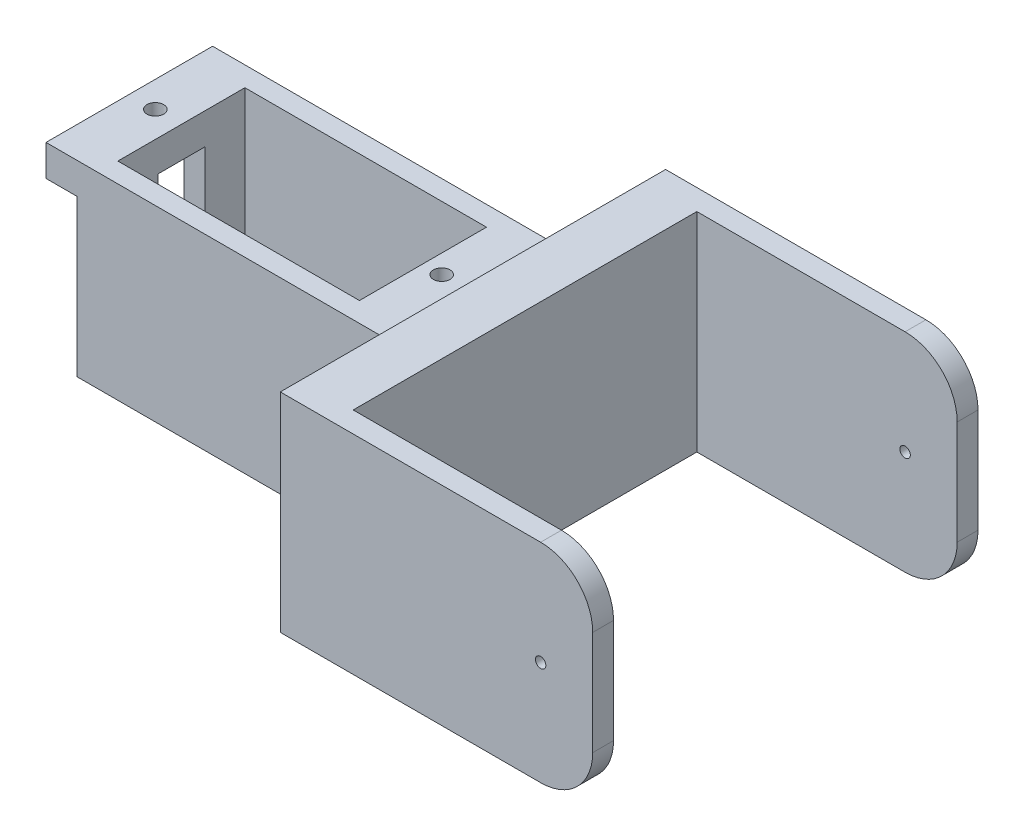
from build123d import *

# Parameters (mm, degrees)
SKETCH1_W               = 30
SKETCH1_H               = 16
BOSS_EXTRUDE1_DEPTH     = 2
SKETCH2_W               = 23.2
SKETCH2_H               = 12.2
BOSS_EXTRUDE2_DEPTH     = 16
CUT_EXTRUDE1_REACH      = 36.234
SKETCH3_W               = 4.5
SKETCH3_H               = 13
SKETCH8_R               = 0.8
CUT_EXTRUDE3_DEPTH      = 2
SKETCH9_W               = 5
SKETCH9_H               = 16
SKETCH9_W_2             = 4
BOSS_EXTRUDE4_DEPTH     = 3
SKETCH10_R              = 0.8
CUT_EXTRUDE4_DEPTH      = 5
SKETCH11_W              = 37
SKETCH11_H              = 20
BOSS_EXTRUDE5_DEPTH     = 5
SKETCH12_W              = 2
SKETCH12_H              = 20
BOSS_EXTRUDE6_DEPTH     = 25
FILLET1_R               = 5
CUT_EXTRUDE5_DEPTH      = 62.278054799
CUT_EXTRUDE5_DEPTH_BACK = 62.278054799
SKETCH13_R              = 0.5


with BuildPart() as part:
    # Sketch1 → Boss-Extrude1 (new body)
    with BuildSketch(Plane(origin=(0, 0, 0), x_dir=(1, 0, 0), z_dir=(0, 1, 0))):
        Rectangle(SKETCH1_W, SKETCH1_H)
    extrude(amount=BOSS_EXTRUDE1_DEPTH)

    # Sketch2 → Boss-Extrude2 (add)
    with BuildSketch(Plane(origin=(0, 2, 0), x_dir=(1, 0, 0), z_dir=(0, 1, 0))):
        Polygon((-15, 8), (-13, 8), (10.2, 8), (15, 8), (15, -8), (10.2, -8), (-13, -8), (-15, -8), align=None)
        with Locations((-1.4, 0)):
            Rectangle(SKETCH2_W, SKETCH2_H, mode=Mode.SUBTRACT)
    extrude(amount=BOSS_EXTRUDE2_DEPTH)

    # Sketch3 → Cut-Extrude1 (cut, up to next)
    with BuildSketch(Plane(origin=(-13, 0, 0), x_dir=(0, 0, -1), z_dir=(1, 0, 0)), mode=Mode.PRIVATE) as cut_extrude1_sk1:
        with Locations((0, 11.5)):
            Rectangle(SKETCH3_W, SKETCH3_H)
    cut_extrude1_tool1 = extrude(cut_extrude1_sk1.sketch, amount=-CUT_EXTRUDE1_REACH, mode=Mode.PRIVATE) & part.part
    add(cut_extrude1_tool1.solids().sort_by_distance((-13, 11.5, 0))[0], mode=Mode.SUBTRACT)

    # Sketch8 → Cut-Extrude3 (cut)
    with BuildSketch(Plane.XZ):
        with Locations(Location((-10, 0, 0), (0, 0, 270))):
            Circle(SKETCH8_R)
    extrude(amount=-CUT_EXTRUDE3_DEPTH, mode=Mode.SUBTRACT)

    # Sketch9 → Boss-Extrude4 (add)
    with BuildSketch(Plane(origin=(0, 18, 0), x_dir=(1, 0, 0), z_dir=(0, 1, 0))):
        with Locations((-15.5, 0)):
            Rectangle(SKETCH9_W, SKETCH9_H)
        with Locations((12.2, 0)):
            Rectangle(SKETCH9_W_2, SKETCH9_H)
    extrude(amount=-BOSS_EXTRUDE4_DEPTH)

    # Sketch10 → Cut-Extrude4 (cut)
    with BuildSketch(Plane(origin=(0, 18, 0), x_dir=(1, 0, 0), z_dir=(0, 1, 0))):
        with Locations(Location((12, 0, 0), (0, 0, 270))):
            Circle(SKETCH10_R)
        with Locations(Location((-15.500971551, 0, 0), (0, 0, 270))):
            Circle(SKETCH10_R)
    extrude(amount=-CUT_EXTRUDE4_DEPTH, mode=Mode.SUBTRACT)

    # Sketch11 → Boss-Extrude5 (add)
    with BuildSketch(Plane(origin=(15, 0, 0), x_dir=(0, 0, -1), z_dir=(1, 0, 0))):
        with Locations((0, 9)):
            Rectangle(SKETCH11_W, SKETCH11_H)
    extrude(amount=BOSS_EXTRUDE5_DEPTH)

    # Sketch12 → Boss-Extrude6 (add)
    with BuildSketch(Plane(origin=(20, 0, 0), x_dir=(0, 0, -1), z_dir=(1, 0, 0))):
        with Locations((-17.5, 9)):
            Rectangle(SKETCH12_W, SKETCH12_H)
        with Locations((17.5, 9)):
            Rectangle(SKETCH12_W, SKETCH12_H)
    extrude(amount=BOSS_EXTRUDE6_DEPTH)

    # Fillet1
    fillet1_edges = [part.edges().sort_by_distance(p)[0] for p in [
        (45, 19, -17.5),
        (45, -1, -17.5),
        (45, 19, 17.5),
        (45, -1, 17.5),
    ]]
    fillet(fillet1_edges, radius=FILLET1_R)

    # Sketch13 → Cut-Extrude5 (cut, two sides: drawn at the far end of the back side and taken through both)
    with BuildSketch(Plane(origin=(0, 0, -18.5), x_dir=(-1, 0, 0), z_dir=(0, 0, -1)).offset(-CUT_EXTRUDE5_DEPTH_BACK)):
        with Locations((-40, 9)):
            Circle(SKETCH13_R)
    extrude(amount=CUT_EXTRUDE5_DEPTH + CUT_EXTRUDE5_DEPTH_BACK, mode=Mode.SUBTRACT)


solid = part.part
